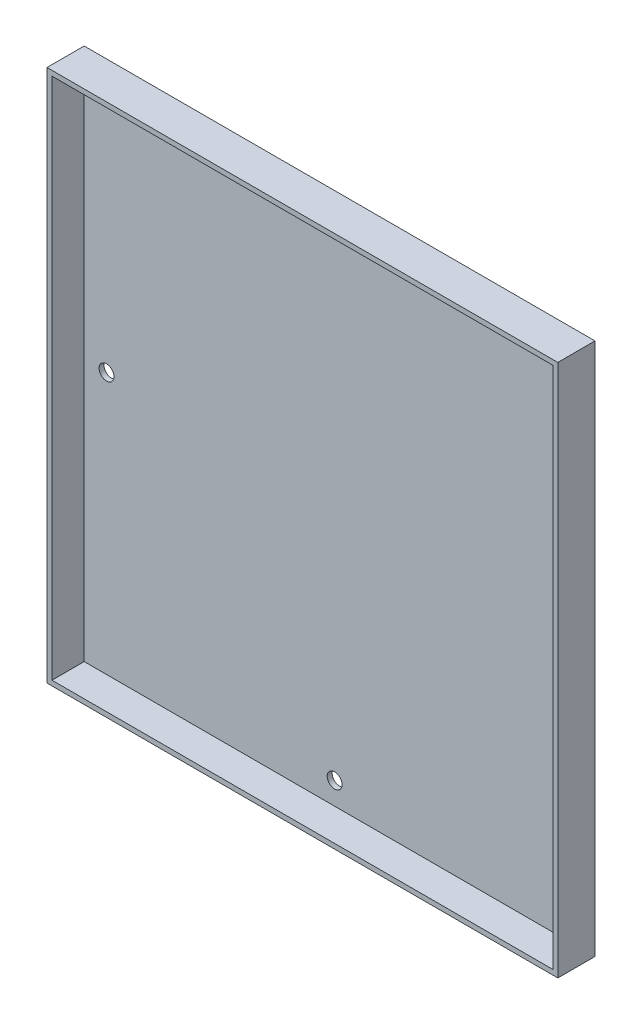
from build123d import *

# Parameters (mm, degrees)
SKETCH_1_W          = 206
SKETCH_1_H          = 215
EXTRUDE_1_DEPTH     = 15
SHELL_1_T           = -2
SKETCH_2_R          = 3
CUT_EXTRUDE_1_DEPTH = 10


with BuildPart() as part:
    # 草图1 → 拉伸1 (new body)
    with BuildSketch(Plane.XY):
        with Locations((103, -107.5)):
            Rectangle(SKETCH_1_W, SKETCH_1_H)
    extrude(amount=EXTRUDE_1_DEPTH)

    # 抽壳1
    shell_1_openings = [part.faces().sort_by_distance(p)[0] for p in [
        (103, -107.5, 15),
    ]]
    offset(amount=SHELL_1_T, openings=shell_1_openings, kind=Kind.INTERSECTION)

    # 草图2 → 切除-拉伸1 (cut)
    with BuildSketch(Plane(origin=(0, 0, 0), x_dir=(-1, 0, 0), z_dir=(0, 0, -1))):
        with Locations((-103, -11)):
            Circle(SKETCH_2_R)
        with Locations((-195, -107.5)):
            Circle(SKETCH_2_R)
        with Locations((-11, -107.5)):
            Circle(SKETCH_2_R)
        with Locations((-103, -204)):
            Circle(SKETCH_2_R)
    extrude(amount=-CUT_EXTRUDE_1_DEPTH, mode=Mode.SUBTRACT)


solid = part.part
